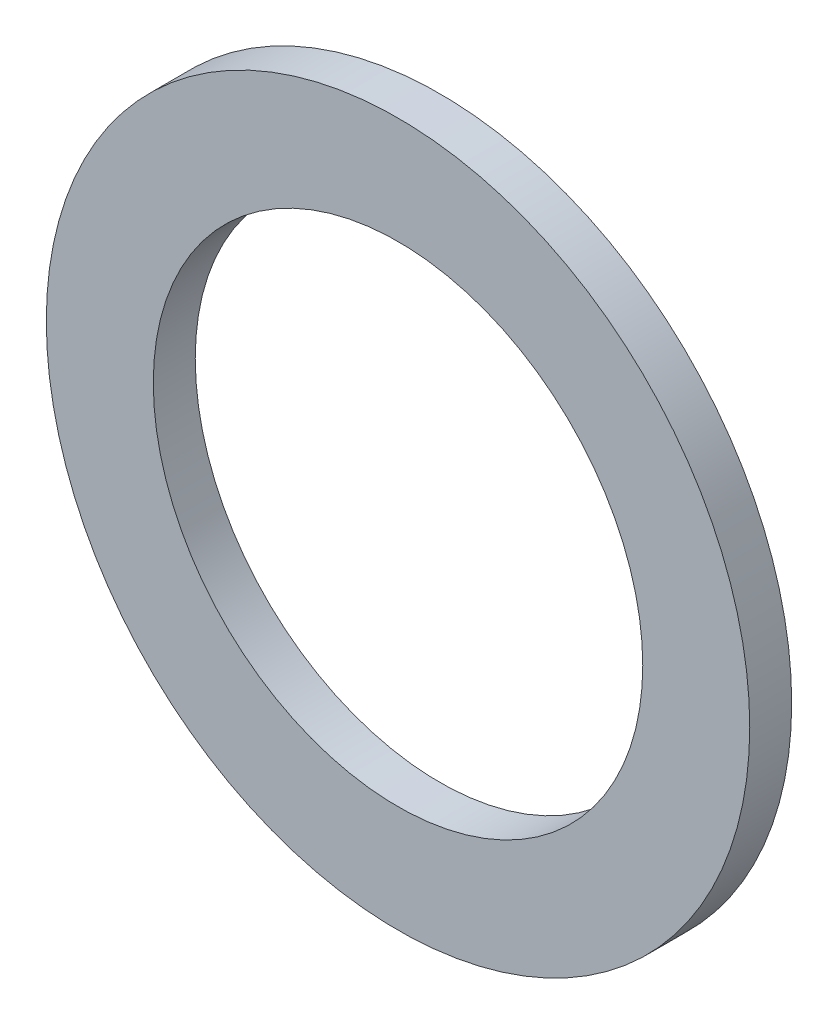
from build123d import *

# Parameters (mm, degrees)
SKETCH2_R           = 25.15
BOSS_EXTRUDE1_DEPTH = 3
SKETCH3_R           = 17.5
CUT_EXTRUDE1_DEPTH  = 3


with BuildPart() as part:
    # Sketch2 → Boss-Extrude1 (new body)
    with BuildSketch(Plane.XY):
        Circle(SKETCH2_R)
    extrude(amount=BOSS_EXTRUDE1_DEPTH)

    # Sketch3 → Cut-Extrude1 (cut)
    with BuildSketch(Plane(origin=(0, 0, 0), x_dir=(-1, 0, 0), z_dir=(0, 0, -1))):
        Circle(SKETCH3_R)
    extrude(amount=-CUT_EXTRUDE1_DEPTH, mode=Mode.SUBTRACT)


solid = part.part
